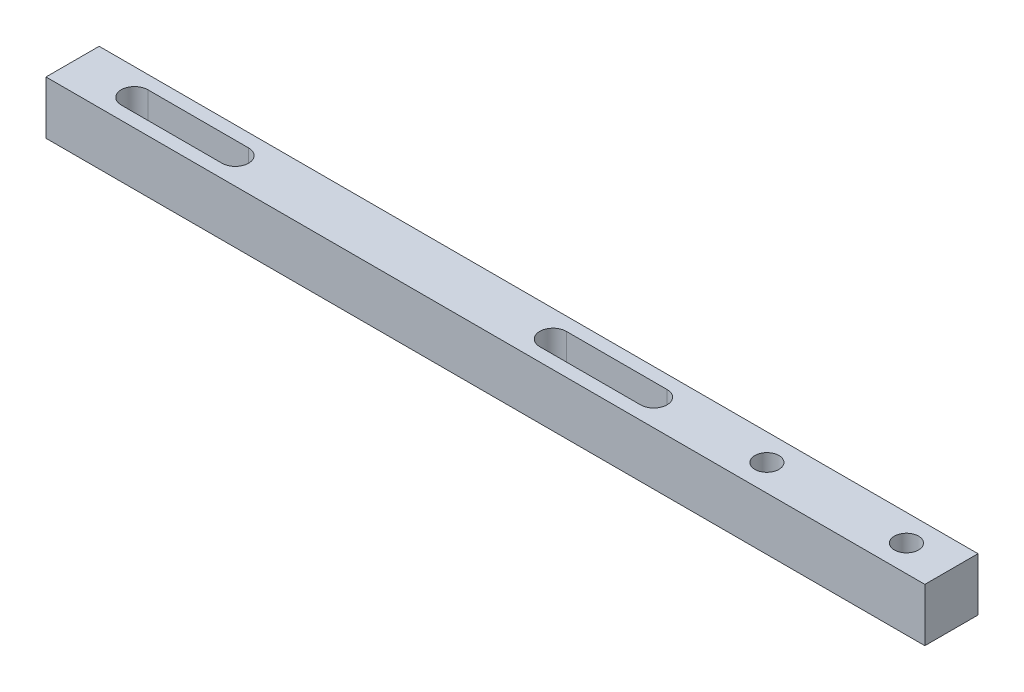
from build123d import *

# Parameters (mm, degrees)
CROQUIS2_W              = 25.4
CROQUIS2_H              = 25.4
SALIENTE_EXTRUIR1_DEPTH = 210
CROQUIS3_R              = 5.765627546
CORTAR_EXTRUIR1_DEPTH   = 212.911420174


with BuildPart() as part:
    # Croquis2 → Saliente-Extruir1 (new, symmetric)
    with BuildSketch(Plane(origin=(0, 0, 0), x_dir=(0, 0, -1), z_dir=(1, 0, 0))):
        Rectangle(CROQUIS2_W, CROQUIS2_H)
    extrude(amount=SALIENTE_EXTRUIR1_DEPTH, both=True)

    # Croquis3 → Cortar-Extruir1 (cut, through all)
    with BuildSketch(Plane(origin=(0, 12.7, 0), x_dir=(1, 0, 0), z_dir=(0, 1, 0))):
        with Locations(Location((121.805313166, 0, 0), (0, 0, 270))):
            Circle(CROQUIS3_R)
        with Locations(Location((188.504509996, 0, 0), (0, 0, 270))):
            Circle(CROQUIS3_R)
        with BuildLine():
            Line((-180.393059191, 6.35), (-132.233607082, 6.35))
            ThreePointArc((-132.233607082, 6.35), (-125.883607082, 0), (-132.233607082, -6.35))
            Line((-132.233607082, -6.35), (-180.393059191, -6.35))
            ThreePointArc((-180.393059191, -6.35), (-186.743059191, 0), (-180.393059191, 6.35))
        make_face()
        with BuildLine():
            Line((19.606940809, 6.35), (67.766392918, 6.35))
            ThreePointArc((67.766392918, 6.35), (74.116392918, 0), (67.766392918, -6.35))
            Line((67.766392918, -6.35), (19.606940809, -6.35))
            ThreePointArc((19.606940809, -6.35), (13.256940809, 0), (19.606940809, 6.35))
        make_face()
    extrude(amount=-CORTAR_EXTRUIR1_DEPTH, mode=Mode.SUBTRACT)


solid = part.part
